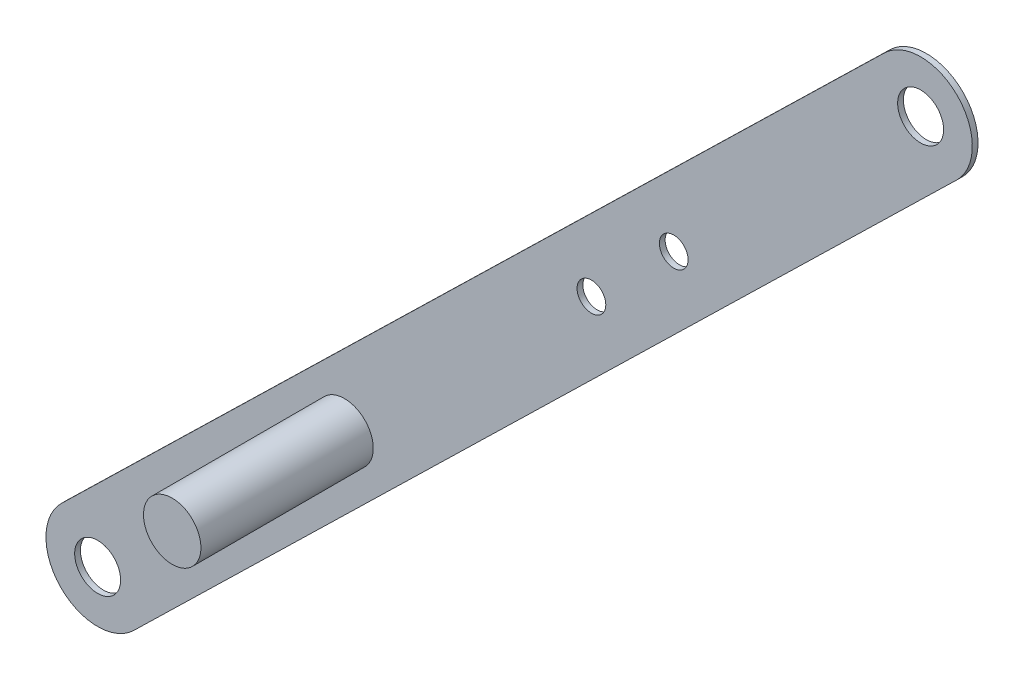
from build123d import *

# Parameters (mm, degrees)
SKETCH1_R           = 4
SKETCH1_R_2         = 2.5
BOSS_EXTRUDE1_DEPTH = 1
SKETCH2_R           = 5
BOSS_EXTRUDE2_DEPTH = 30


with BuildPart() as part:
    # Sketch1 → Boss-Extrude1 (new body)
    with BuildSketch(Plane.XY):
        with BuildLine():
            Line((6.279627947, -6.447191082), (-136.991284981, -145.994478797))
            ThreePointArc((-136.991284981, -145.994478797), (-149.71810401, -145.826915663), (-149.550540875, -133.100096634))
            Line((-149.550540875, -133.100096634), (-6.279627947, 6.447191082))
            ThreePointArc((-6.279627947, 6.447191082), (6.447191082, 6.279627947), (6.279627947, -6.447191082))
        make_face()
        Circle(SKETCH1_R, mode=Mode.SUBTRACT)
        with Locations((-143.270912928, -139.547287716)):
            Circle(SKETCH1_R, mode=Mode.SUBTRACT)
        with Locations((-42.981273878, -41.864186315)):
            Circle(SKETCH1_R_2, mode=Mode.SUBTRACT)
        with Locations((-57.308365171, -55.818915086)):
            Circle(SKETCH1_R_2, mode=Mode.SUBTRACT)
    extrude(amount=BOSS_EXTRUDE1_DEPTH)

    # Sketch2 → Boss-Extrude2 (add)
    with BuildSketch(Plane.XY.offset(1)):
        with Locations((-100.28963905, -97.683101401)):
            Circle(SKETCH2_R)
    extrude(amount=BOSS_EXTRUDE2_DEPTH)


solid = part.part
